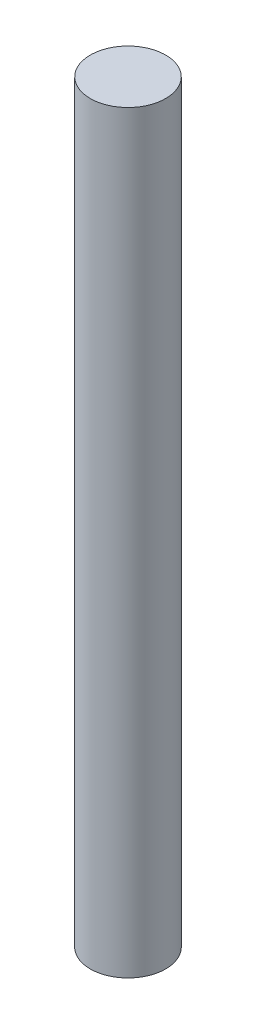
from build123d import *

# Parameters (mm, degrees)
SKETCH_1_R      = 7.5
EXTRUDE_1_DEPTH = 150


with BuildPart() as part:
    # 草图1 → 凸台-拉伸1 (new body)
    with BuildSketch(Plane(origin=(0, 0, 0), x_dir=(1, 0, 0), z_dir=(0, 1, 0))):
        with Locations(Location((0, 0, 0), (0, 0, 270))):
            Circle(SKETCH_1_R)
    extrude(amount=EXTRUDE_1_DEPTH)


solid = part.part
